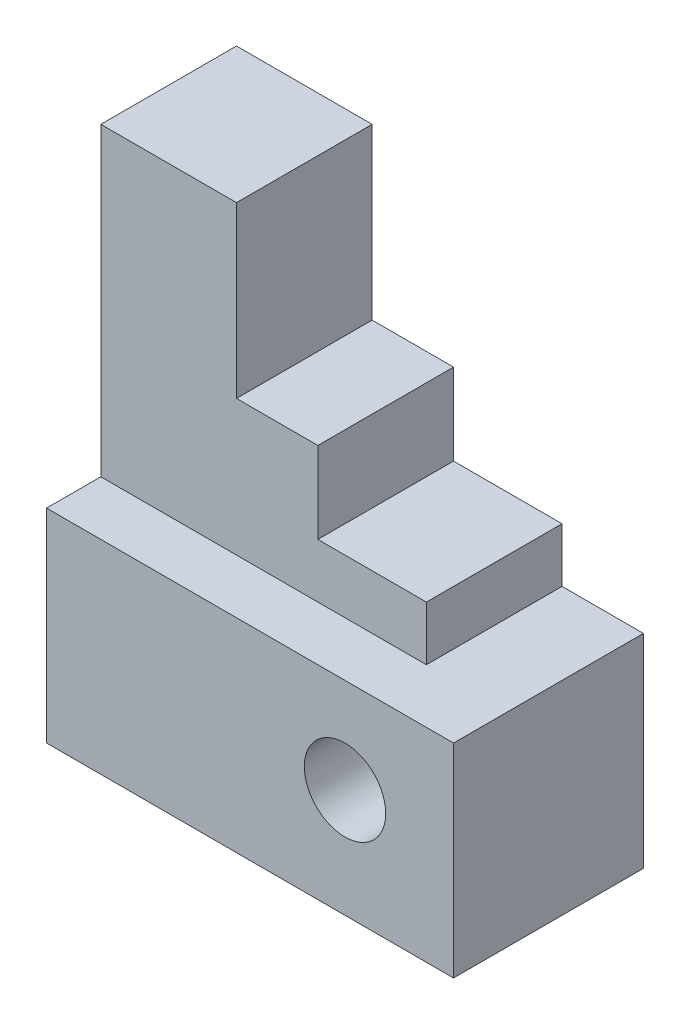
from build123d import *

# Parameters (mm, degrees)
SKETCH3_R           = 6
BOSS_EXTRUDE2_DEPTH = 20
BOSS_EXTRUDE3_START = 20
SKETCH3_3_R         = 6
BOSS_EXTRUDE3_DEPTH = 8


with BuildPart() as part:
    # Sketch3 → Boss-Extrude2 (new body)
    with BuildSketch(Plane.XY):
        Polygon((0, 0), (0, 75), (20, 75), (20, 50), (32, 50), (32, 38), (48, 38), (48, 30), (60, 30), (60, 0), align=None)
        with Locations((44, 16)):
            Circle(SKETCH3_R, mode=Mode.SUBTRACT)
    extrude(amount=BOSS_EXTRUDE2_DEPTH)

    # Sketch3<3> → Boss-Extrude3 (add)
    with BuildSketch(Plane.XY.offset(BOSS_EXTRUDE3_START)):
        Polygon((0, 30), (0, 0), (60, 0), (60, 30), (48, 30), align=None)
        with Locations((44, 16)):
            Circle(SKETCH3_3_R, mode=Mode.SUBTRACT)
    extrude(amount=BOSS_EXTRUDE3_DEPTH)


solid = part.part
